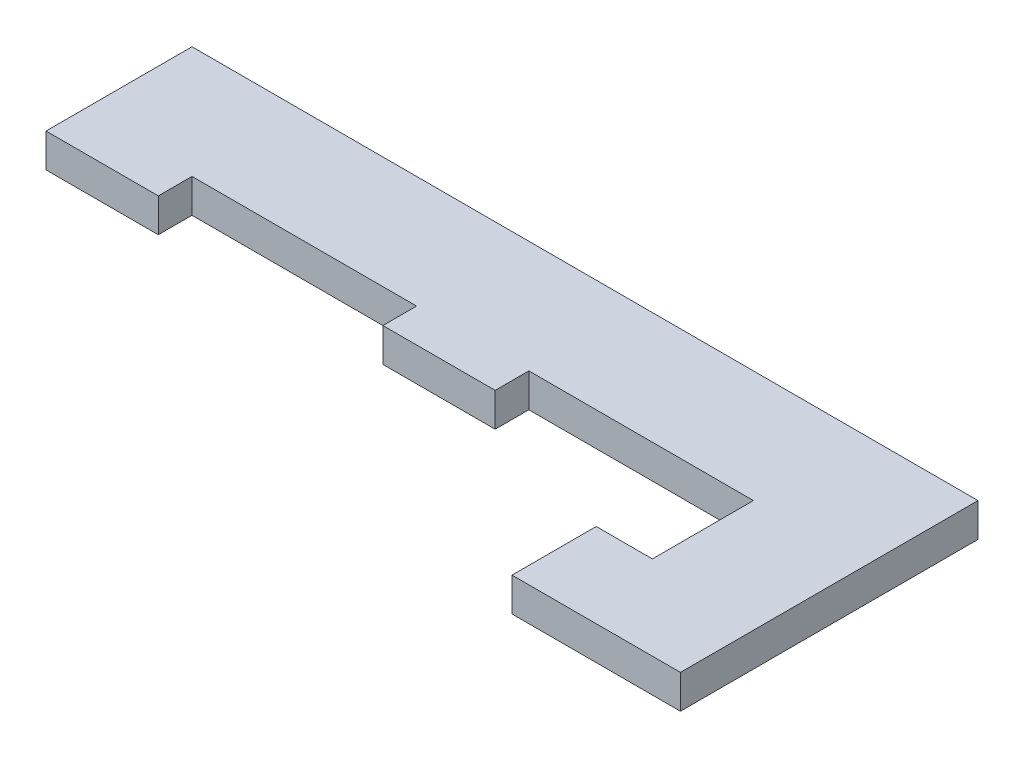
from build123d import *

# Parameters (mm, degrees)
BOSS_EXTRUDE1_DEPTH = 6


with BuildPart() as part:
    # Sketch1 → Boss-Extrude1 (new body)
    with BuildSketch(Plane(origin=(0, 0, 0), x_dir=(1, 0, 0), z_dir=(0, 1, 0))):
        Polygon((0, -53), (0, 0), (-140, 0), (-140, -26), (-120, -26), (-120, -20), (-80, -20), (-80, -26), (-60, -26), (-60, -20), (-20, -20), (-20, -38), (-30, -38), (-30, -53), align=None)
    extrude(amount=BOSS_EXTRUDE1_DEPTH)


solid = part.part
